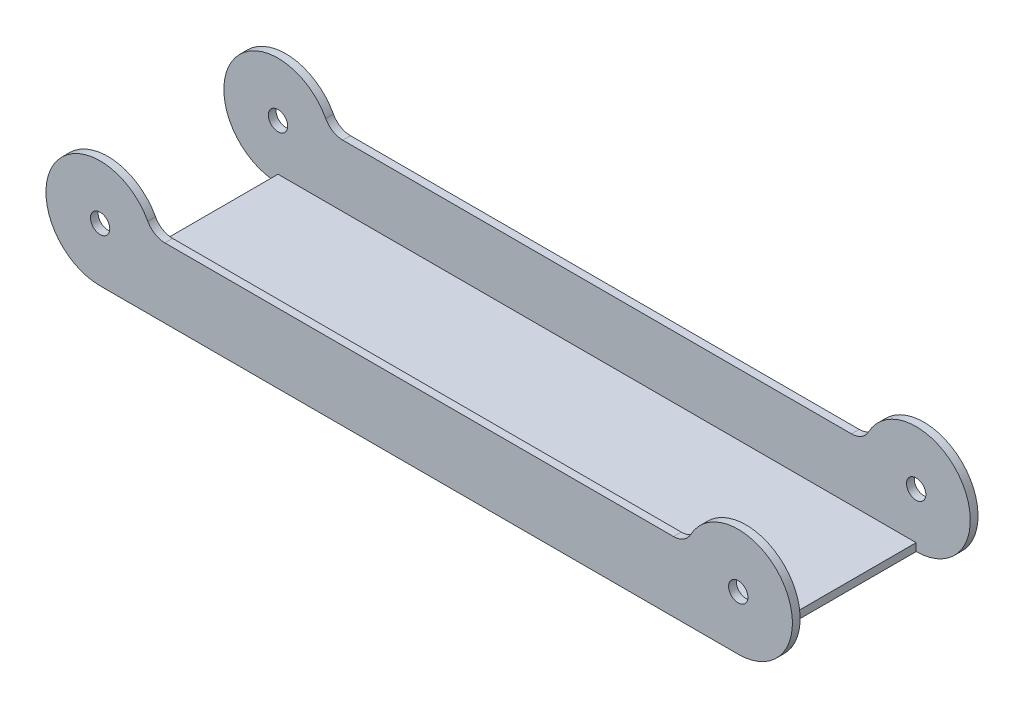
from build123d import *

# Parameters (mm, degrees)
SKETCH2_W                      = 195
SKETCH2_H                      = 48
BOSS_EXTRUDE1_DEPTH            = 14
SHELL1_T                       = -2
SKETCH3_R                      = 2.5
CUT_EXTRUDE1_DEPTH             = 110.573035004
CUT_EXTRUDE2_REACH             = 196.99
SKETCH4_W                      = 44
SKETCH4_H                      = 26
CUT_EXTRUDE2_DIRECTION_2_REACH = 196.99
CUT_EXTRUDE3_DEPTH             = 102.381704464
CUT_EXTRUDE3_DEPTH_BACK        = 102.381704464
CUT_EXTRUDE4_REACH             = 105.307
SKETCH7_W                      = 7.211102551
SKETCH7_H                      = 44
FILLET1_R                      = 5


with BuildPart() as part:
    # Sketch2 → Boss-Extrude1 (new, symmetric)
    with BuildSketch(Plane(origin=(0, 0, 0), x_dir=(1, 0, 0), z_dir=(0, 1, 0))):
        Rectangle(SKETCH2_W, SKETCH2_H)
    extrude(amount=BOSS_EXTRUDE1_DEPTH, both=True)

    # Shell1
    shell1_openings = [part.faces().sort_by_distance(p)[0] for p in [
        (0, 14, 0),
    ]]
    offset(amount=SHELL1_T, openings=shell1_openings, kind=Kind.INTERSECTION)

    # Sketch3 → Cut-Extrude1 (cut, through all)
    with BuildSketch(Plane.XY.offset(24)):
        with Locations((-82.5, 0)):
            Circle(SKETCH3_R)
        with Locations((82.5, 0)):
            Circle(SKETCH3_R)
    extrude(amount=-CUT_EXTRUDE1_DEPTH, mode=Mode.SUBTRACT)

    # Sketch4 → Cut-Extrude2 (cut, up to next)
    with BuildSketch(Plane(origin=(-95.5, 0, 0), x_dir=(0, 0, -1), z_dir=(1, 0, 0)), mode=Mode.PRIVATE) as cut_extrude2_sk1:
        with Locations((0, 1)):
            Rectangle(SKETCH4_W, SKETCH4_H)
    cut_extrude2_tool1 = extrude(cut_extrude2_sk1.sketch, amount=-CUT_EXTRUDE2_REACH, mode=Mode.PRIVATE) & part.part
    add(cut_extrude2_tool1.solids().sort_by_distance((-95.5, 1, 0))[0], mode=Mode.SUBTRACT)

    # Sketch4 → Cut-Extrude2 direction 2 (cut, up to next)
    with BuildSketch(Plane(origin=(-95.5, 0, 0), x_dir=(0, 0, -1), z_dir=(1, 0, 0)), mode=Mode.PRIVATE) as cut_extrude2_direction_2_sk1:
        with Locations((0, 1)):
            Rectangle(SKETCH4_W, SKETCH4_H)
    cut_extrude2_direction_2_tool1 = extrude(cut_extrude2_direction_2_sk1.sketch, amount=CUT_EXTRUDE2_DIRECTION_2_REACH, mode=Mode.PRIVATE) & part.part
    add(cut_extrude2_direction_2_tool1.solids().sort_by_distance((-95.5, 1, 0))[0], mode=Mode.SUBTRACT)

    # Sketch6 → Cut-Extrude3 (cut, two sides: drawn at the far end of the back side and taken through both)
    with BuildSketch(Plane.XY.offset(-CUT_EXTRUDE3_DEPTH_BACK)):
        with BuildLine():
            Line((-69.083592135, 4), (69.083592135, 4))
            ThreePointArc((69.083592135, 4), (93.72497216, 8.366600265), (82.5, -14))
            Line((82.5, -14), (97.5, -14))
            Line((97.5, -14), (97.5, 24))
            Line((97.5, 24), (-97.5, 24))
            Line((-97.5, 24), (-97.5, -14))
            Line((-97.5, -14), (-82.5, -14))
            ThreePointArc((-82.5, -14), (-93.72497216, 8.366600265), (-69.083592135, 4))
        make_face()
    extrude(amount=CUT_EXTRUDE3_DEPTH + CUT_EXTRUDE3_DEPTH_BACK, mode=Mode.SUBTRACT)

    # Sketch7 → Cut-Extrude4 (cut, up to next)
    with BuildSketch(Plane.XZ.offset(14), mode=Mode.PRIVATE) as cut_extrude4_sk1:
        with Locations((86.105551276, 0)):
            Rectangle(SKETCH7_W, SKETCH7_H)
    cut_extrude4_tool1 = extrude(cut_extrude4_sk1.sketch, amount=-CUT_EXTRUDE4_REACH, mode=Mode.PRIVATE) & part.part
    # Sketch7 → Cut-Extrude4 (cut, up to next)
    with BuildSketch(Plane.XZ.offset(14), mode=Mode.PRIVATE) as cut_extrude4_sk2:
        with Locations((-86.105551276, 0)):
            Rectangle(SKETCH7_W, SKETCH7_H)
    cut_extrude4_tool2 = extrude(cut_extrude4_sk2.sketch, amount=-CUT_EXTRUDE4_REACH, mode=Mode.PRIVATE) & part.part
    add(cut_extrude4_tool1.solids().sort_by_distance((86.105551, -14, 0))[0], mode=Mode.SUBTRACT)
    add(cut_extrude4_tool2.solids().sort_by_distance((-86.105551, -14, 0))[0], mode=Mode.SUBTRACT)

    # Fillet1
    fillet1_edges = [part.edges().sort_by_distance(p)[0] for p in [
        (69.083592135, 4, -23),
        (-69.083592135, 4, 23),
        (-69.083592135, 4, -23),
        (69.083592135, 4, 23),
    ]]
    fillet(fillet1_edges, radius=FILLET1_R)


solid = part.part
